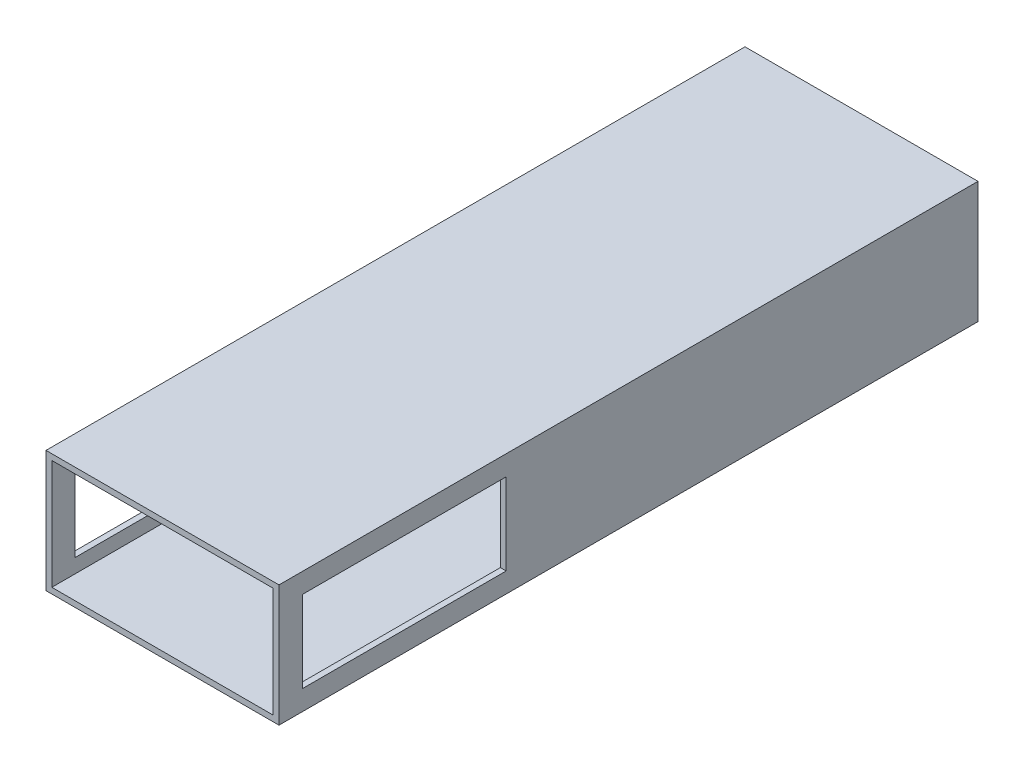
from build123d import *

# Parameters (mm, degrees)
CROQUIS1_W              = 40
CROQUIS1_H              = 20.86
CROQUIS1_W_2            = 38
CROQUIS1_H_2            = 18.86
SALIENTE_EXTRUIR1_DEPTH = 120
CROQUIS2_W              = 35
CROQUIS2_H              = 14
CORTAR_EXTRUIR1_DEPTH   = 120


with BuildPart() as part:
    # Croquis1 → Saliente-Extruir1 (new body)
    with BuildSketch(Plane.XY):
        Rectangle(CROQUIS1_W, CROQUIS1_H)
        Rectangle(CROQUIS1_W_2, CROQUIS1_H_2, mode=Mode.SUBTRACT)
    extrude(amount=SALIENTE_EXTRUIR1_DEPTH)

    # Croquis2 → Cortar-Extruir1 (cut)
    with BuildSketch(Plane.ZY.offset(20)):
        with Locations((98.5, 0)):
            Rectangle(CROQUIS2_W, CROQUIS2_H)
    extrude(amount=-CORTAR_EXTRUIR1_DEPTH, mode=Mode.SUBTRACT)


solid = part.part
